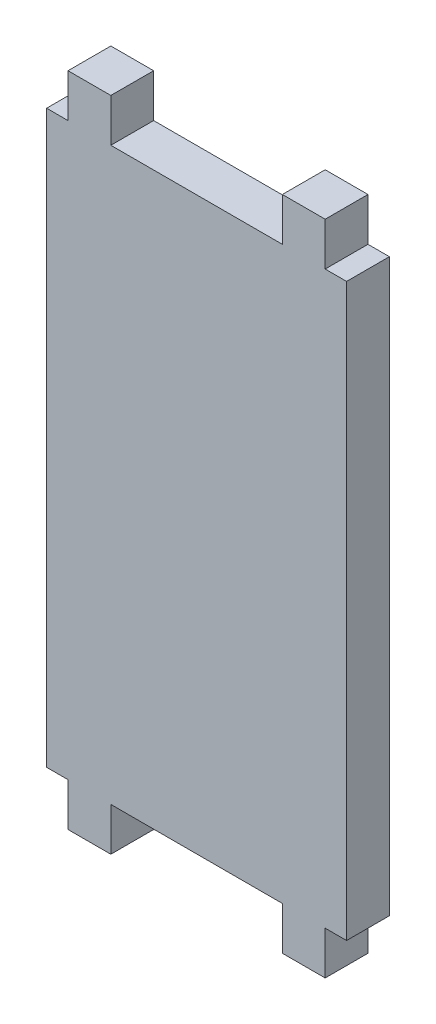
from build123d import *

# Parameters (mm, degrees)
SALIENTE_EXTRUIR1_DEPTH = 6


with BuildPart() as part:
    # Model → Saliente-Extruir1 (new body)
    with BuildSketch(Plane.XY):
        Polygon((31.979489095, 103.95), (37.979489095, 103.95), (37.97951386, 110), (62.019755438, 110), (62.019669685, 103.95), (68.019669685, 103.95), (68.019755438, 110), (71.019755439, 110), (71.020889365, 190), (68.020889364, 190), (68.020975118, 196.05), (62.020975117, 196.05), (62.020889364, 190), (37.979841336, 190), (37.979866102, 196.05), (31.979866102, 196.05), (31.979841336, 190), (28.979489095, 190), (28.979489095, 110), (31.97951386, 110), align=None)
    extrude(amount=SALIENTE_EXTRUIR1_DEPTH)


solid = part.part
